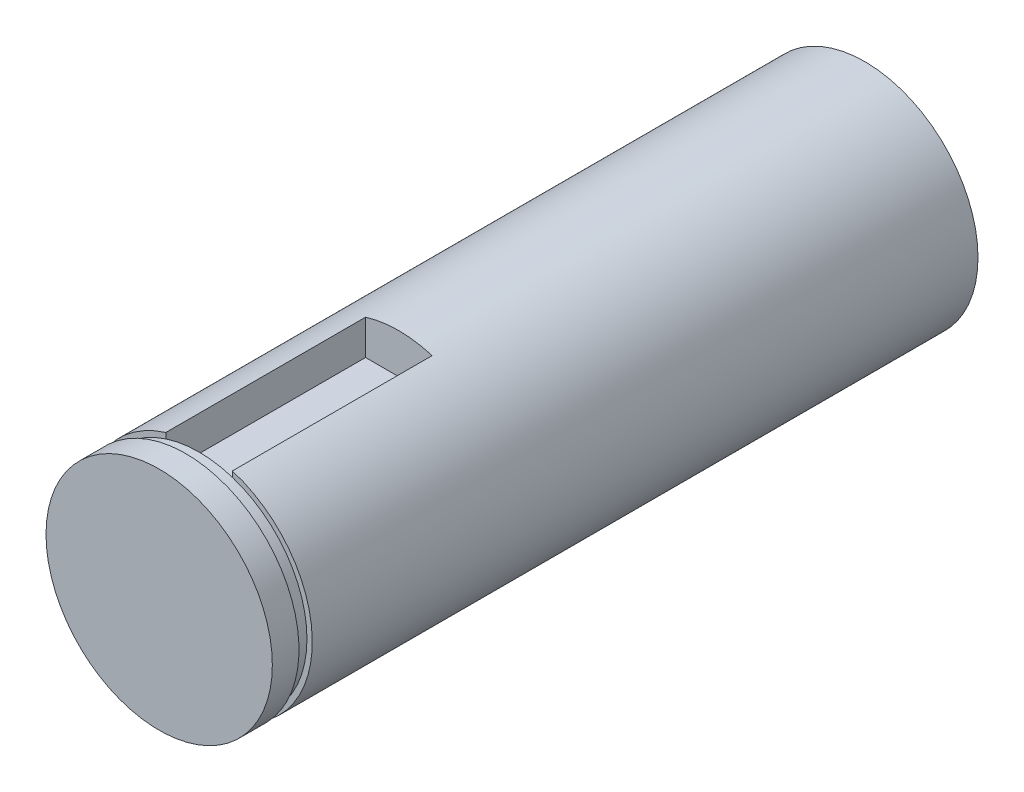
from build123d import *

# Parameters (mm, degrees)
SKETCH1_R           = 8.5
BOSS_EXTRUDE1_DEPTH = 50
SKETCH2_W           = 5
SKETCH2_H           = 3
CUT_EXTRUDE1_DEPTH  = 15
SKETCH3_R           = 8.5
BOSS_EXTRUDE2_DEPTH = 3
SKETCH4_R           = 9
SKETCH4_R_2         = 8.1
CUT_EXTRUDE2_DEPTH  = 1


with BuildPart() as part:
    # Sketch1 → Boss-Extrude1 (new body)
    with BuildSketch(Plane.XY):
        Circle(SKETCH1_R)
    extrude(amount=BOSS_EXTRUDE1_DEPTH)

    # Sketch2 → Cut-Extrude1 (cut)
    with BuildSketch(Plane.XY.offset(50)):
        with Locations((0, 7)):
            Rectangle(SKETCH2_W, SKETCH2_H)
    extrude(amount=-CUT_EXTRUDE1_DEPTH, mode=Mode.SUBTRACT)

    # Sketch3 → Boss-Extrude2 (add)
    with BuildSketch(Plane.XY.offset(50)):
        Circle(SKETCH3_R)
    extrude(amount=BOSS_EXTRUDE2_DEPTH)

    # Sketch4 → Cut-Extrude2 (cut)
    with BuildSketch(Plane(origin=(0, 0, 50), x_dir=(-1, 0, 0), z_dir=(0, 0, -1))):
        Circle(SKETCH4_R)
        Circle(SKETCH4_R_2, mode=Mode.SUBTRACT)
    extrude(amount=-CUT_EXTRUDE2_DEPTH, mode=Mode.SUBTRACT)


solid = part.part
